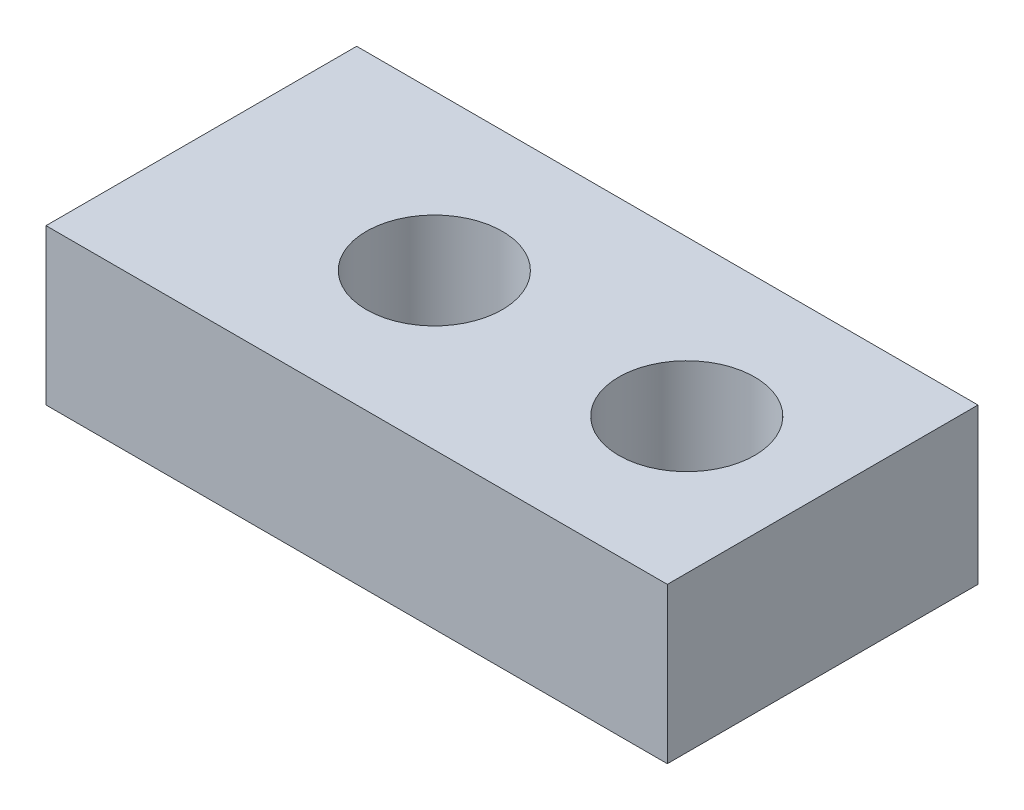
from build123d import *

# Parameters (mm, degrees)
SKETCH1_W           = 25.4
SKETCH1_H           = 12.7
BOSS_EXTRUDE2_DEPTH = 6.35
SKETCH2_R           = 2.778125
CUT_EXTRUDE1_DEPTH  = 6.35


with BuildPart() as part:
    # Sketch1 → Boss-Extrude2 (new body)
    with BuildSketch(Plane(origin=(0, 0, 0), x_dir=(1, 0, 0), z_dir=(0, 1, 0))):
        with Locations((12.7, 6.35)):
            Rectangle(SKETCH1_W, SKETCH1_H)
    extrude(amount=BOSS_EXTRUDE2_DEPTH)

    # Sketch2 → Cut-Extrude1 (cut)
    with BuildSketch(Plane(origin=(0, 6.35, 0), x_dir=(1, 0, 0), z_dir=(0, 1, 0))):
        with Locations(Location((19.84375, 6.35, 0), (0, 0, 270))):
            Circle(SKETCH2_R)
        with Locations(Location((9.525, 6.35, 0), (0, 0, 270))):
            Circle(SKETCH2_R)
    extrude(amount=-CUT_EXTRUDE1_DEPTH, mode=Mode.SUBTRACT)


solid = part.part
